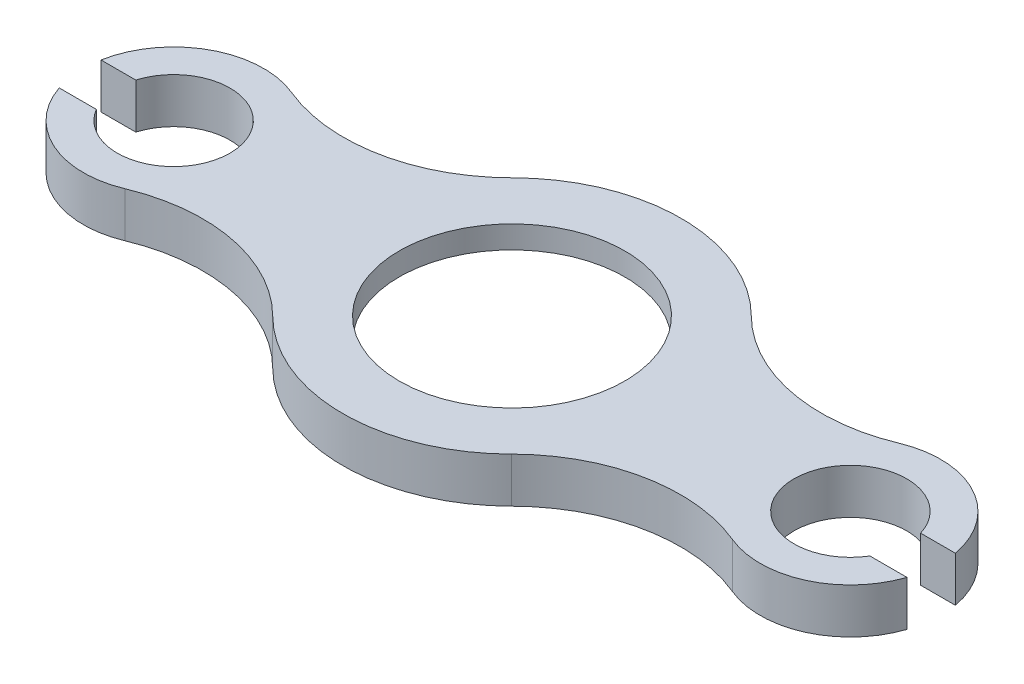
from build123d import *

# Parameters (mm, degrees)
SKETCH6_R           = 50
SKETCH6_R_2         = 25
BOSS_EXTRUDE6_DEPTH = 20
SKETCH6_8_R         = 67.8
CUT_EXTRUDE11_DEPTH = 10
SKETCH9_W           = 21.167456462
SKETCH9_H           = 20
CUT_EXTRUDE13_DEPTH = 30


with BuildPart() as part:
    # Sketch6 → Boss-Extrude6 (new body)
    with BuildSketch(Plane(origin=(0, 0, 0), x_dir=(1, 0, 0), z_dir=(0, 1, 0))):
        with BuildLine():
            ThreePointArc((-52.958333333, -53.107578843), (0, -75), (52.958333333, -53.107578843))
            ThreePointArc((52.958333333, -53.107578843), (91.362529225, -32.640861336), (134.666666667, -36.944402673))
            ThreePointArc((134.666666667, -36.944402673), (190, 0), (134.666666667, 36.944402673))
            ThreePointArc((134.666666667, 36.944402673), (91.362529225, 32.640861336), (52.958333333, 53.107578843))
            ThreePointArc((52.958333333, 53.107578843), (0, 75), (-52.958333333, 53.107578843))
            ThreePointArc((-52.958333333, 53.107578843), (-91.362529225, 32.640861336), (-134.666666667, 36.944402673))
            ThreePointArc((-134.666666667, 36.944402673), (-190, 0), (-134.666666667, -36.944402673))
            ThreePointArc((-134.666666667, -36.944402673), (-91.362529225, -32.640861336), (-52.958333333, -53.107578843))
        make_face()
        Circle(SKETCH6_R, mode=Mode.SUBTRACT)
        with Locations((150, 0)):
            Circle(SKETCH6_R_2, mode=Mode.SUBTRACT)
        with Locations((-150, 0)):
            Circle(SKETCH6_R_2, mode=Mode.SUBTRACT)
    extrude(amount=BOSS_EXTRUDE6_DEPTH)

    # Sketch6<8> → Cut-Extrude11 (cut)
    with BuildSketch(Plane(origin=(0, 0, 0), x_dir=(1, 0, 0), z_dir=(0, 1, 0))):
        Circle(SKETCH6_8_R)
    extrude(amount=CUT_EXTRUDE11_DEPTH, mode=Mode.SUBTRACT)

    # Sketch9 → Cut-Extrude13 (cut)
    with BuildSketch(Plane.XZ):
        with Locations((181.273098249, 2.816509548)):
            Rectangle(SKETCH9_W, SKETCH9_H)
        with Locations((-181.273098249, 2.816509548)):
            Rectangle(SKETCH9_W, SKETCH9_H)
    extrude(amount=-CUT_EXTRUDE13_DEPTH, mode=Mode.SUBTRACT)


solid = part.part
